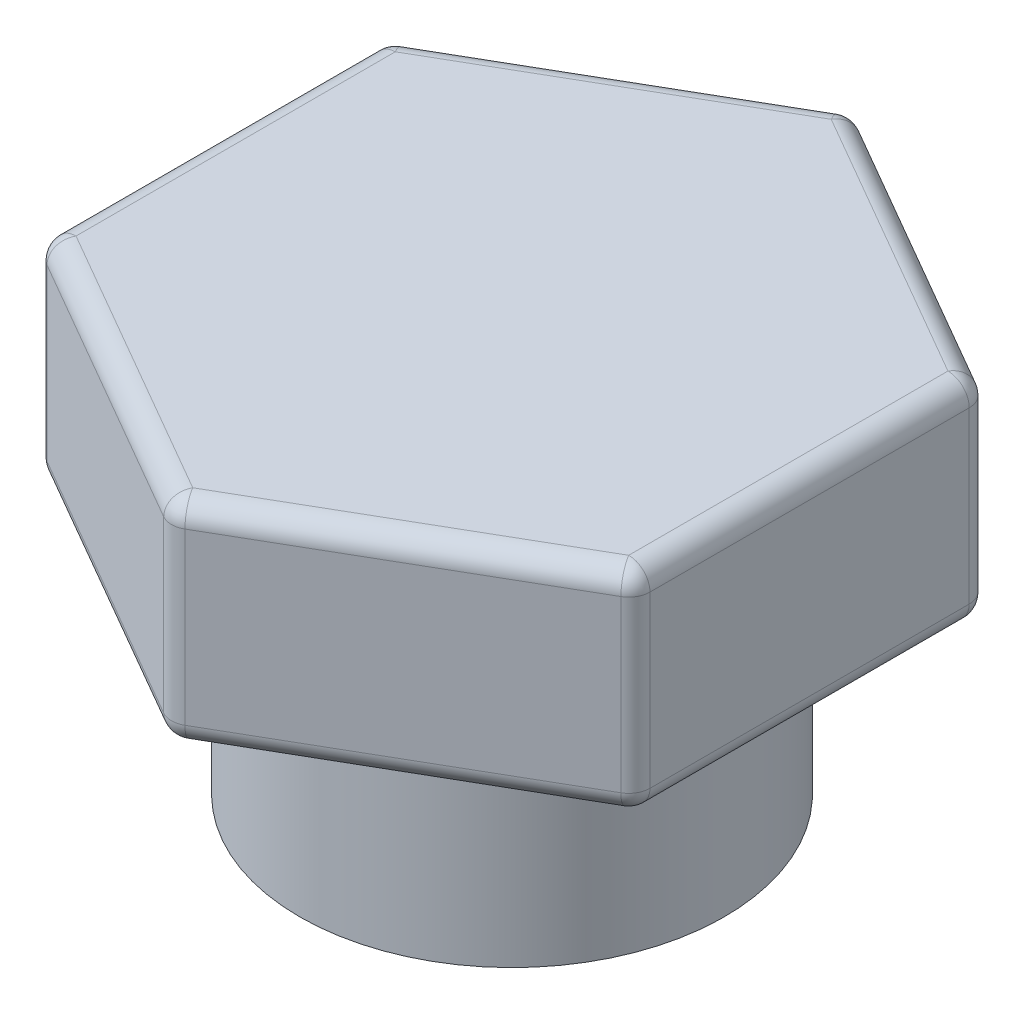
from build123d import *

# Parameters (mm, degrees)
SKETCH1_R           = 5
BOSS_EXTRUDE1_DEPTH = 5
BOSS_EXTRUDE2_DEPTH = 5
FILLET1_R           = 0.5


with BuildPart() as part:
    # Sketch1 → Boss-Extrude1 (new body)
    with BuildSketch(Plane(origin=(0, 0, 0), x_dir=(1, 0, 0), z_dir=(0, 1, 0))):
        with Locations(Location((0, 0, 0), (0, 0, 270))):
            Circle(SKETCH1_R)
    extrude(amount=BOSS_EXTRUDE1_DEPTH)

    # Sketch2 → Boss-Extrude2 (add)
    with BuildSketch(Plane(origin=(0, 5, 0), x_dir=(1, 0, 0), z_dir=(0, 1, 0))):
        Polygon((7.004330674, -4.046297386), (7.006361665, 4.042779607), (0.002030991, 8.089076993), (-7.004330674, 4.046297386), (-7.006361665, -4.042779607), (-0.002030991, -8.089076993), align=None)
    extrude(amount=BOSS_EXTRUDE2_DEPTH)

    # Fillet1
    fillet1_edges = [part.edges().sort_by_distance(p)[0] for p in [
        (3.501149842, 5, 6.06768719),
        (-0.002030991, 7.5, 8.089076993),
        (7.00534617, 5, 0.00175889),
        (7.004330674, 7.5, 4.046297386),
        (3.504196328, 5, -6.0659283),
        (7.006361665, 7.5, -4.042779607),
        (-3.501149842, 5, -6.06768719),
        (0.002030991, 7.5, -8.089076993),
        (-7.00534617, 5, -0.00175889),
        (-7.004330674, 7.5, -4.046297386),
        (-3.504196328, 5, 6.0659283),
        (-7.006361665, 7.5, 4.042779607),
        (3.501149842, 10, 6.06768719),
        (7.00534617, 10, 0.00175889),
        (3.504196328, 10, -6.0659283),
        (-3.501149842, 10, -6.06768719),
        (-7.00534617, 10, -0.00175889),
        (-3.504196328, 10, 6.0659283),
    ]]
    fillet(fillet1_edges, radius=FILLET1_R)


solid = part.part
